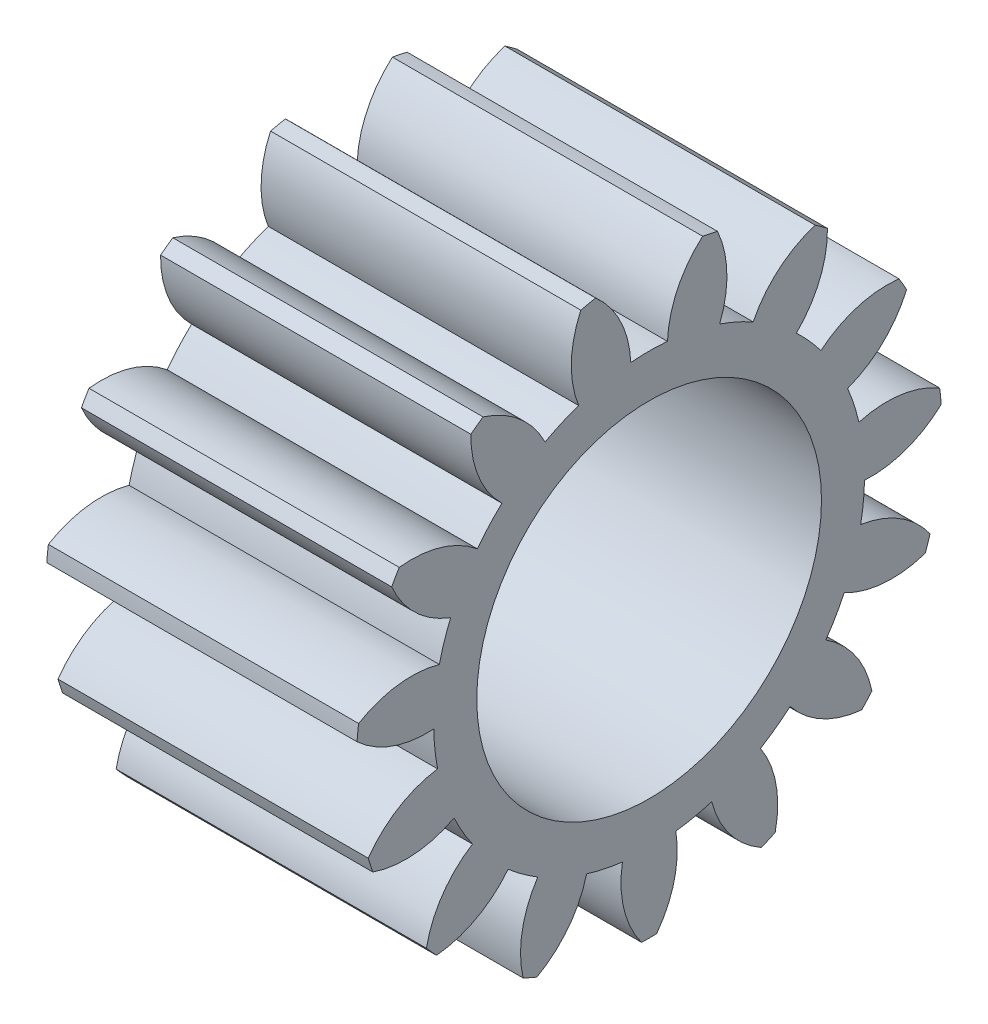
from build123d import *

# Parameters (mm, degrees)
BASPROSKE_W        = 9
BASPROSKE_H        = 8.5
TOOTHCUT_DEPTH     = 16.016657418
TEETHCUTS_COUNT    = 15
TEETHCUTS_ANGLE    = 336
BORSKE_R           = 3
BORE_DEPTH         = 50.0000508
SKETCH1_R          = 5
CUT_EXTRUDE1_DEPTH = 9


with BuildPart() as part:
    # BasProSke → Base-Revolve (revolve)
    with BuildSketch(Plane(origin=(0, 0, 0), x_dir=(1, 0, 0), z_dir=(0, 1, 0)), mode=Mode.PRIVATE) as base_revolve_sk:
        with Locations((4.5, 4.25)):
            Rectangle(BASPROSKE_W, BASPROSKE_H)
    revolve(base_revolve_sk.sketch.rotate(Axis((-10, 0, 0), (1, 0, 0)), 180), axis=Axis((-10, 0, 0), (1, 0, 0)))

    # TooCutSke → ToothCut (cut, through all)
    with BuildSketch(Plane(origin=(0, 0, 0), x_dir=(0, 0, -1), z_dir=(1, 0, 0))):
        with BuildLine():
            ThreePointArc((0.531576138, 6.226349477), (0, 6.249), (-0.531576138, 6.226349477))
            ThreePointArc((-0.531576138, 6.226349477), (-0.830301624, 7.411024729), (-1.576608494, 8.378350125))
            ThreePointArc((-1.576608494, 8.378350125), (0, 8.5254), (1.576608494, 8.378350125))
            ThreePointArc((1.576608494, 8.378350125), (0.830301624, 7.411024729), (0.531576138, 6.226349477))
        make_face()
    toothcut = extrude(amount=TOOTHCUT_DEPTH, mode=Mode.SUBTRACT)

    # TeethCuts: ToothCut ×15 about axis
    teethcuts_axis = Axis((-10, 0, 0), (1, 0, 0))
    for i in range(1, TEETHCUTS_COUNT):
        add(toothcut.rotate(teethcuts_axis, i * TEETHCUTS_ANGLE / (TEETHCUTS_COUNT - 1)), mode=Mode.SUBTRACT)

    # BorSke → Bore (cut, symmetric)
    with BuildSketch(Plane(origin=(0, 0, 0), x_dir=(0, 0, -1), z_dir=(1, 0, 0))):
        with Locations(Location((0, 0, 0), (0, 0, 180))):
            Circle(BORSKE_R)
    extrude(amount=BORE_DEPTH, both=True, mode=Mode.SUBTRACT)

    # Sketch1 → Cut-Extrude1 (cut)
    with BuildSketch(Plane(origin=(9, 0, 0), x_dir=(0, 0, -1), z_dir=(1, 0, 0))):
        Circle(SKETCH1_R)
    extrude(amount=-CUT_EXTRUDE1_DEPTH, mode=Mode.SUBTRACT)


solid = part.part
